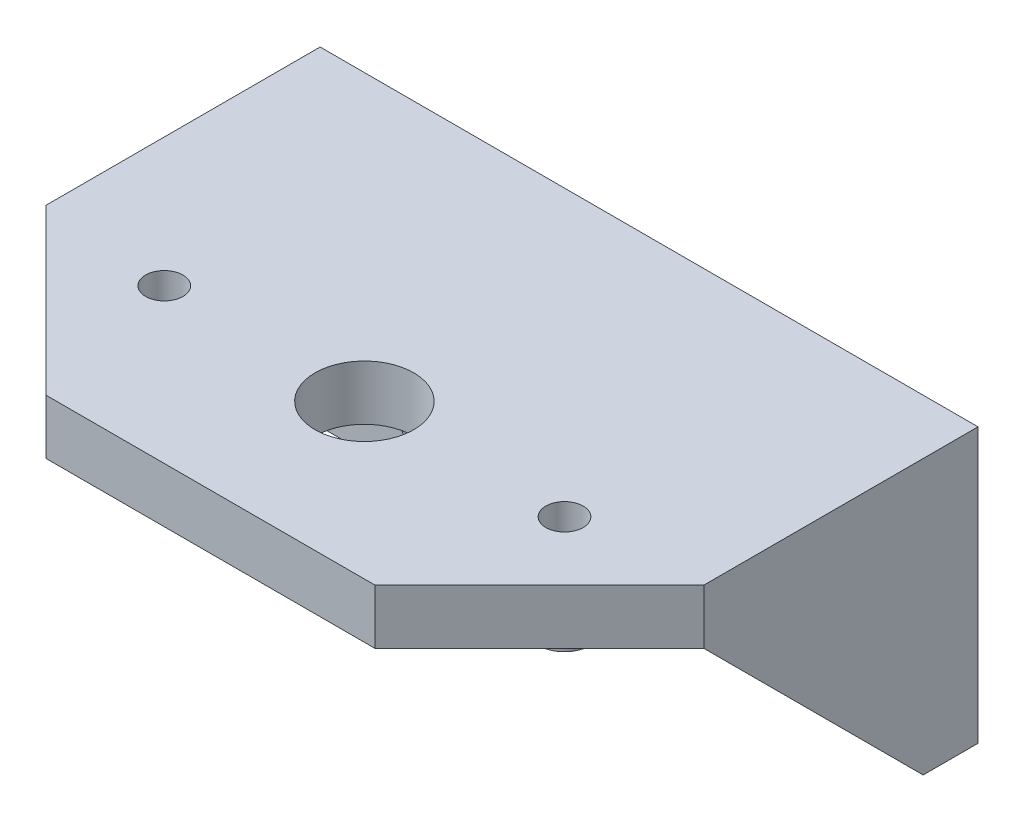
from build123d import *

# Parameters (mm, degrees)
SKETCH1_R             = 1.7
BOSS_EXTRUDE1_DEPTH   = 5
SKETCH3_W             = 60
SKETCH3_H             = 35
SKETCH3_R             = 4.5
SKETCH3_R_2           = 2.5
BOSS_EXTRUDE2_DEPTH   = 5
SKETCH4_R             = 3
CUT_EXTRUDE1_DEPTH    = 3
SKETCH11_R            = 2.35
SKETCH11_R_2          = 1.7
BOSS_EXTRUDE3_DEPTH   = 4
BOSS_EXTRUDE3_2_DEPTH = 4
SKETCH12_R            = 2.658625551
SKETCH12_R_2          = 1.7
SKETCH12_R_3          = 2.826964015
BOSS_EXTRUDE4_DEPTH   = 5
CHAMFER1_SIZE         = 15
BOSS_EXTRUDE5_DEPTH   = 3
BOSS_EXTRUDE6_DEPTH   = 3
CHAMFER2_SIZE         = 2
CHAMFER2_SIZE2        = 1


with BuildPart() as part:
    # Sketch1 → Boss-Extrude1 (new body)
    # profile 1 of 4: a face of its own
    with BuildSketch(Plane.XY):
        Polygon((111.623766163, 210.92362241), (111.623766163, 235.92362241), (96.623766163, 235.92362241), (91.623766163, 235.92362241), (91.623766163, 225.92362241), (91.623766163, 215.92362241), (91.623766163, 210.92362241), (96.623766163, 210.92362241), align=None)
        with Locations((96.623766163, 215.92362241)):
            Circle(SKETCH1_R, mode=Mode.SUBTRACT)
        with Locations((96.623766163, 225.92362241)):
            Circle(SKETCH1_R, mode=Mode.SUBTRACT)
    # profile 2 of 4: a face of its own
    with BuildSketch(Plane.XY):
        Polygon((126.623766163, 235.92362241), (111.623766163, 235.92362241), (111.623766163, 210.92362241), (126.623766163, 210.92362241), (131.623766163, 210.92362241), (131.623766163, 215.92362241), (131.623766163, 225.92362241), (131.623766163, 235.92362241), align=None)
        with Locations((126.623766163, 215.92362241)):
            Circle(SKETCH1_R, mode=Mode.SUBTRACT)
        with Locations((126.623766163, 225.92362241)):
            Circle(SKETCH1_R, mode=Mode.SUBTRACT)
    # profile 3 of 4: a face of its own
    with BuildSketch(Plane.XY):
        Polygon((91.623766163, 225.92362241), (91.623766163, 235.92362241), (81.623766163, 235.92362241), (81.623766163, 210.92362241), (91.623766163, 210.92362241), (91.623766163, 215.92362241), align=None)
    # profile 4 of 4: a face of its own
    with BuildSketch(Plane.XY):
        Polygon((141.623766163, 235.92362241), (131.623766163, 235.92362241), (131.623766163, 225.92362241), (131.623766163, 215.92362241), (131.623766163, 210.92362241), (141.623766163, 210.92362241), align=None)
    extrude(amount=BOSS_EXTRUDE1_DEPTH)

    # Sketch3 → Boss-Extrude2 (add)
    with BuildSketch(Plane(origin=(0, 235.92362241, 0), x_dir=(1, 0, 0), z_dir=(0, 1, 0))):
        with Locations((111.623766163, -22.5)):
            Rectangle(SKETCH3_W, SKETCH3_H)
        with Locations(Location((111.623766163, -25.961896785, 0), (0, 0, 180))):
            Circle(SKETCH3_R, mode=Mode.SUBTRACT)
        with Locations(Location((129.873766163, -25.961896785, 0), (0, 0, 180))):
            Circle(SKETCH3_R_2, mode=Mode.SUBTRACT)
        with Locations(Location((93.373766163, -25.961896785, 0), (0, 0, 180))):
            Circle(SKETCH3_R_2, mode=Mode.SUBTRACT)
    extrude(amount=-BOSS_EXTRUDE2_DEPTH)

    # Sketch4 → Cut-Extrude1 (cut)
    with BuildSketch(Plane.XY.offset(5)):
        with Locations((126.623766163, 215.92362241)):
            Circle(SKETCH4_R)
        with Locations((126.623766163, 225.92362241)):
            Circle(SKETCH4_R)
        with Locations((96.623766163, 225.92362241)):
            Circle(SKETCH4_R)
        with Locations((96.623766163, 215.92362241)):
            Circle(SKETCH4_R)
    extrude(amount=-CUT_EXTRUDE1_DEPTH, mode=Mode.SUBTRACT)



with BuildPart() as body_2:
    # Sketch11 → Boss-Extrude3 (new body)
    with BuildSketch(Plane.XZ.offset(-230.92362241)):
        with Locations((129.873766163, 25.961896785)):
            Circle(SKETCH11_R)
        with Locations((129.873766163, 25.961896785)):
            Circle(SKETCH11_R_2, mode=Mode.SUBTRACT)
    extrude(amount=BOSS_EXTRUDE3_DEPTH)


with BuildPart() as body_3:
    # Sketch11 → Boss-Extrude3 2 (new body)
    with BuildSketch(Plane.XZ.offset(-230.92362241)):
        with Locations((93.373766163, 25.961896785)):
            Circle(SKETCH11_R)
        with Locations((93.373766163, 25.961896785)):
            Circle(SKETCH11_R_2, mode=Mode.SUBTRACT)
    extrude(amount=BOSS_EXTRUDE3_2_DEPTH)


with BuildPart() as part_1:
    add(part.part)

    add(body_2.part)  # Boss-Extrude4 merges body 2

    add(body_3.part)  # Boss-Extrude4 merges body 3
    # Sketch12 → Boss-Extrude4 (add)
    # profile 1 of 2: a face of its own
    with BuildSketch(Plane(origin=(0, 230.92362241, 0), x_dir=(1, 0, 0), z_dir=(0, 1, 0))):
        with Locations((129.873766163, -25.961896785)):
            Circle(SKETCH12_R)
        with Locations((129.873766163, -25.961896785)):
            Circle(SKETCH12_R_2, mode=Mode.SUBTRACT)
    # profile 2 of 2: a face of its own
    with BuildSketch(Plane(origin=(0, 230.92362241, 0), x_dir=(1, 0, 0), z_dir=(0, 1, 0))):
        with Locations((93.373766163, -25.961896785)):
            Circle(SKETCH12_R_3)
        with Locations((93.373766163, -25.961896785)):
            Circle(SKETCH12_R_2, mode=Mode.SUBTRACT)
    extrude(amount=BOSS_EXTRUDE4_DEPTH)

    # Chamfer1
    chamfer1_edges = [part_1.edges().sort_by_distance(p)[0] for p in [
        (141.623766163, 233.42362241, 40),
        (81.623766163, 233.42362241, 40),
    ]]
    chamfer(chamfer1_edges, length=CHAMFER1_SIZE)

    # Sketch13 → Boss-Extrude5 (add)
    with BuildSketch(Plane.ZY.offset(-81.623766163)):
        Polygon((25, 230.92362241), (5, 210.92362241), (5, 230.92362241), align=None)
        Polygon((5, 210.92362241), (5, 230.92362241), (25, 230.92362241), (25, 235.92362241), (0, 235.92362241), (0, 210.92362241), align=None)
    extrude(amount=-BOSS_EXTRUDE5_DEPTH)

    # Sketch14 → Boss-Extrude6 (add)
    with BuildSketch(Plane(origin=(141.623766163, 0, 0), x_dir=(0, 0, -1), z_dir=(1, 0, 0))):
        Polygon((-5, 210.92362241), (-25, 230.92362241), (-5, 230.92362241), align=None)
        Polygon((0, 210.92362241), (0, 235.92362241), (-25, 235.92362241), (-25, 230.92362241), (-5, 230.92362241), (-5, 210.92362241), align=None)
    extrude(amount=-BOSS_EXTRUDE6_DEPTH)

    # Chamfer2
    chamfer2_edges = [part_1.edges().sort_by_distance(p)[0] for p in [
        (91.023766163, 230.92362241, 25.961896785),
        (127.523766163, 230.92362241, 25.961896785),
    ]]
    chamfer2_side = [part_1.faces().sort_by_distance(p)[0] for p in [
        (111.623766163, 230.92362241, 21.140138657),
    ]]
    chamfer(chamfer2_edges, length=CHAMFER2_SIZE, length2=CHAMFER2_SIZE2, reference=chamfer2_side[0])


solid = part_1.part
